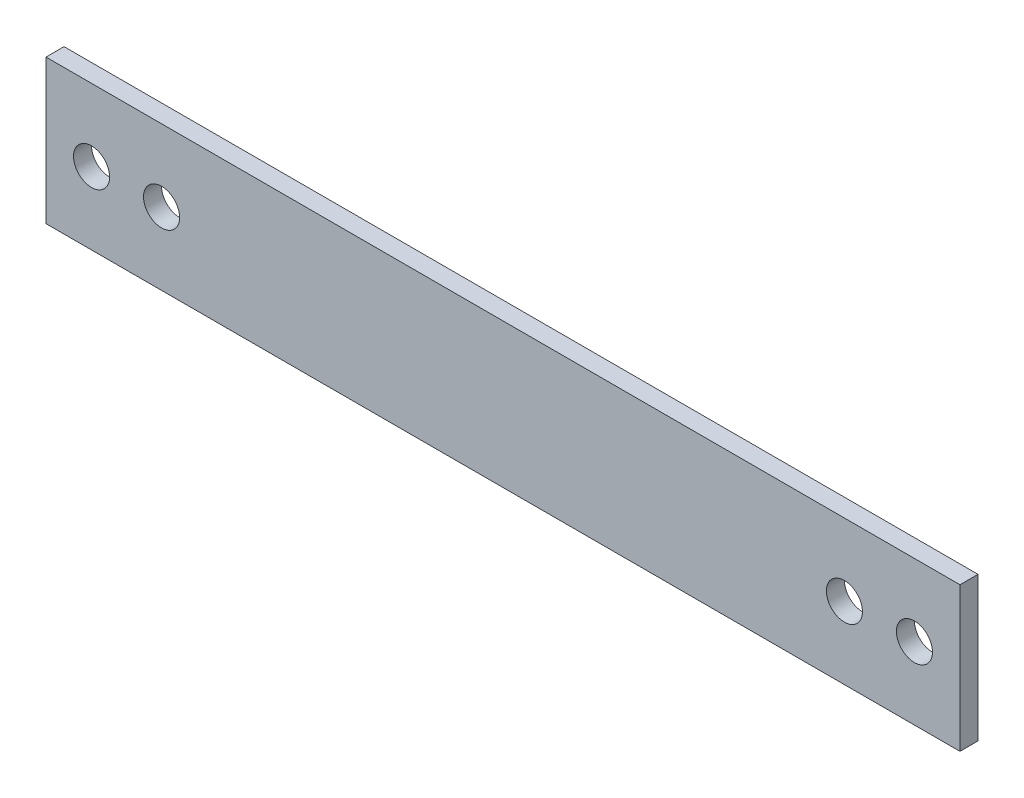
from build123d import *

# Parameters (mm, degrees)
SKETCH1_W           = 241.3
SKETCH1_H           = 38.1
SKETCH1_R           = 4.7625
BOSS_EXTRUDE1_DEPTH = 4.7625


with BuildPart() as part:
    # Sketch1 → Boss-Extrude1 (new body)
    with BuildSketch(Plane.XY):
        Rectangle(SKETCH1_W, SKETCH1_H)
        with Locations(Location((-108.625531915, 0, 0), (0, 0, 180))):
            Circle(SKETCH1_R, mode=Mode.SUBTRACT)
        with Locations(Location((-90.142978723, 0, 0), (0, 0, 180))):
            Circle(SKETCH1_R, mode=Mode.SUBTRACT)
        with Locations(Location((90.142978723, 0, 0), (0, 0, 180))):
            Circle(SKETCH1_R, mode=Mode.SUBTRACT)
        with Locations(Location((108.625531915, 0, 0), (0, 0, 180))):
            Circle(SKETCH1_R, mode=Mode.SUBTRACT)
    extrude(amount=BOSS_EXTRUDE1_DEPTH)


solid = part.part
